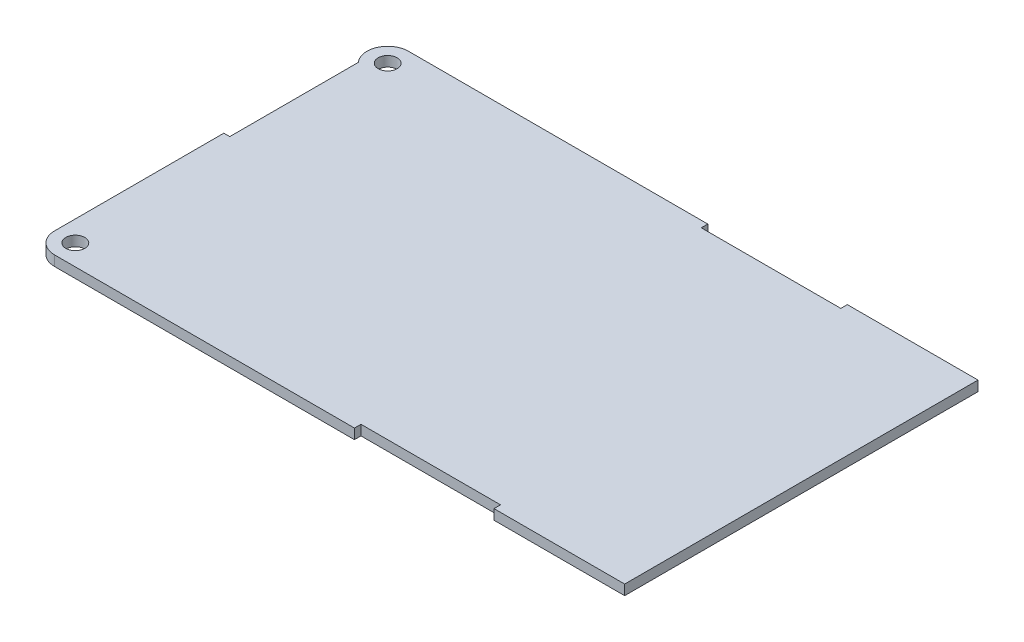
from build123d import *

# Parameters (mm, degrees)
SKETCH1_R           = 1.6
BOSS_EXTRUDE1_DEPTH = 1.7


with BuildPart() as part:
    # Sketch1 → Boss-Extrude1 (new body)
    with BuildSketch(Plane(origin=(0, 0, 0), x_dir=(1, 0, 0), z_dir=(0, 1, 0))):
        with BuildLine():
            ThreePointArc((0, 3.5), (1.025126266, 1.025126266), (3.5, 0))
            Line((3.5, 0), (54, 0))
            Line((54, 0), (54, 1.1))
            Line((54, 1.1), (77.5, 1.1))
            Line((77.5, 1.1), (77.5, 0))
            Line((77.5, 0), (99.5, 0))
            Line((99.5, 0), (99.5, 59.5))
            Line((99.5, 59.5), (77.5, 59.5))
            Line((77.5, 59.5), (77.5, 58.4))
            Line((77.5, 58.4), (54, 58.4))
            Line((54, 58.4), (54, 59.5))
            Line((54, 59.5), (3.6, 59.5))
            ThreePointArc((3.6, 59.5), (0.402285022, 57.422891043), (1, 53.656925097))
            Line((1, 53.656925097), (1, 32))
            Line((1, 32), (0, 32))
            Line((0, 32), (0, 3.5))
        make_face()
        with Locations(Location((3.5, 3.5, 0), (0, 0, 270))):
            Circle(SKETCH1_R, mode=Mode.SUBTRACT)
        with Locations(Location((3.6, 56, 0), (0, 0, 270))):
            Circle(SKETCH1_R, mode=Mode.SUBTRACT)
    extrude(amount=BOSS_EXTRUDE1_DEPTH)


solid = part.part
